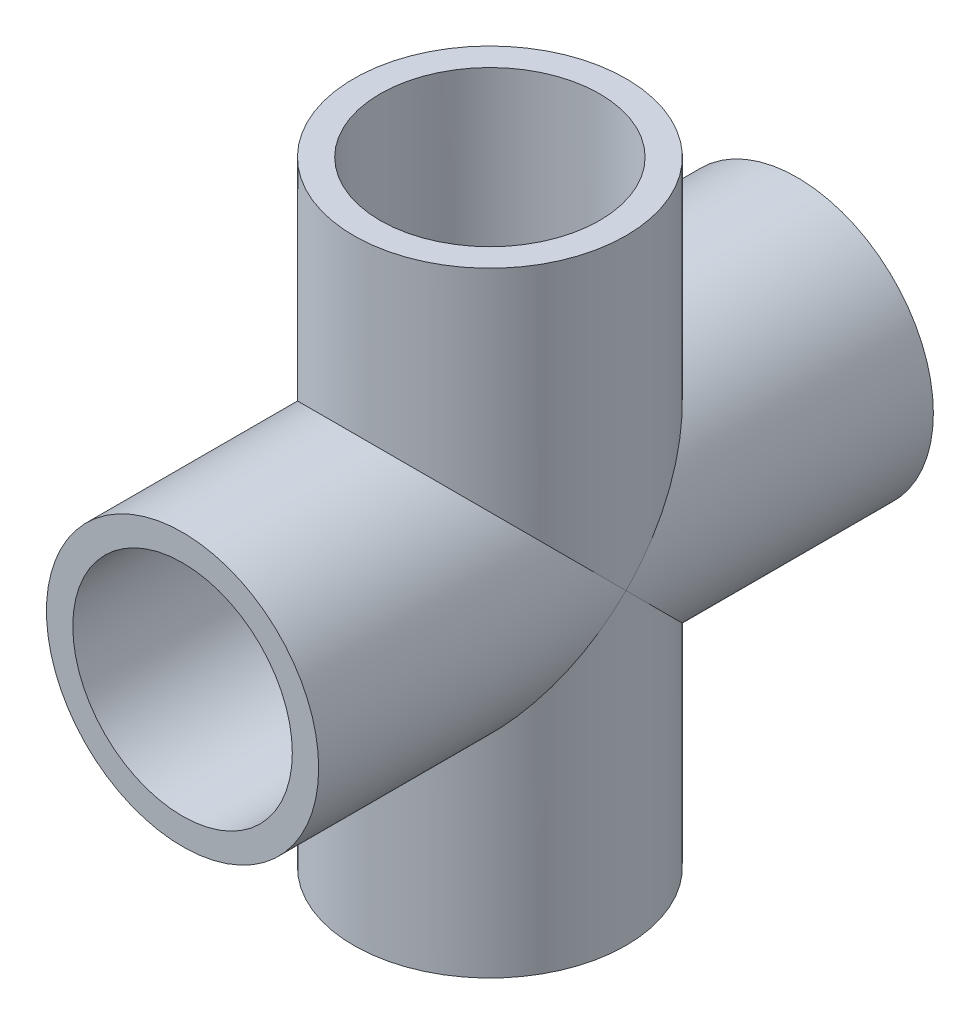
from build123d import *

# Parameters (mm, degrees)
SKETCH1_R           = 15.5
SKETCH1_R_2         = 12.5
EXTRUDE_THIN1_DEPTH = 35
SKETCH2_R           = 15.5
SKETCH2_R_2         = 12.5
EXTRUDE_THIN2_DEPTH = 35
SCALE1_SCALE        = 0.5


with BuildPart() as part:
    # Sketch1 → Extrude-Thin1 (new, symmetric)
    with BuildSketch(Plane.XY):
        Circle(SKETCH1_R)
        Circle(SKETCH1_R_2, mode=Mode.SUBTRACT)
    extrude(amount=EXTRUDE_THIN1_DEPTH, both=True)

    # Sketch2 → Extrude-Thin2 (add, symmetric)
    with BuildSketch(Plane(origin=(0, 0, 0), x_dir=(1, 0, 0), z_dir=(0, 1, 0))):
        Circle(SKETCH2_R)
        Circle(SKETCH2_R_2, mode=Mode.SUBTRACT)
    extrude(amount=EXTRUDE_THIN2_DEPTH, both=True)


with BuildPart() as part_1:
    # Scale1: scaled about (0, 0, 0)
    add(part.part.scale(SCALE1_SCALE))


solid = part_1.part
